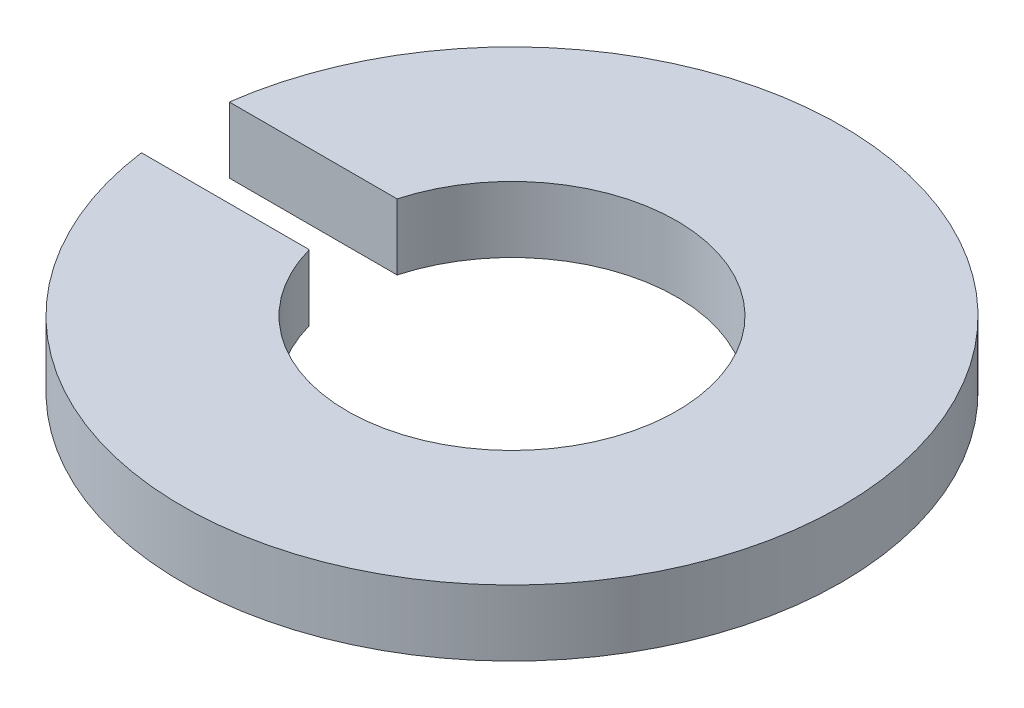
from build123d import *

# Parameters (mm, degrees)
SKETCH2_R           = 1.5
SKETCH2_R_2         = 0.75
BOSS_EXTRUDE1_DEPTH = 0.3
SKETCH3_W           = 1.187579266
SKETCH3_H           = 0.4
CUT_EXTRUDE1_DEPTH  = 0.3


with BuildPart() as part:
    # Sketch2 → Boss-Extrude1 (new body)
    with BuildSketch(Plane(origin=(0, 0, 0), x_dir=(1, 0, 0), z_dir=(0, 1, 0))):
        with Locations(Location((0, 0, 0), (0, 0, 270))):
            Circle(SKETCH2_R)
        with Locations(Location((0, 0, 0), (0, 0, 270))):
            Circle(SKETCH2_R_2, mode=Mode.SUBTRACT)
    extrude(amount=BOSS_EXTRUDE1_DEPTH)

    # Sketch3 → Cut-Extrude1 (cut)
    with BuildSketch(Plane(origin=(0, 0.3, 0), x_dir=(1, 0, 0), z_dir=(0, 1, 0))):
        with Locations((-1.292091921, 0)):
            Rectangle(SKETCH3_W, SKETCH3_H)
    extrude(amount=-CUT_EXTRUDE1_DEPTH, mode=Mode.SUBTRACT)


solid = part.part
